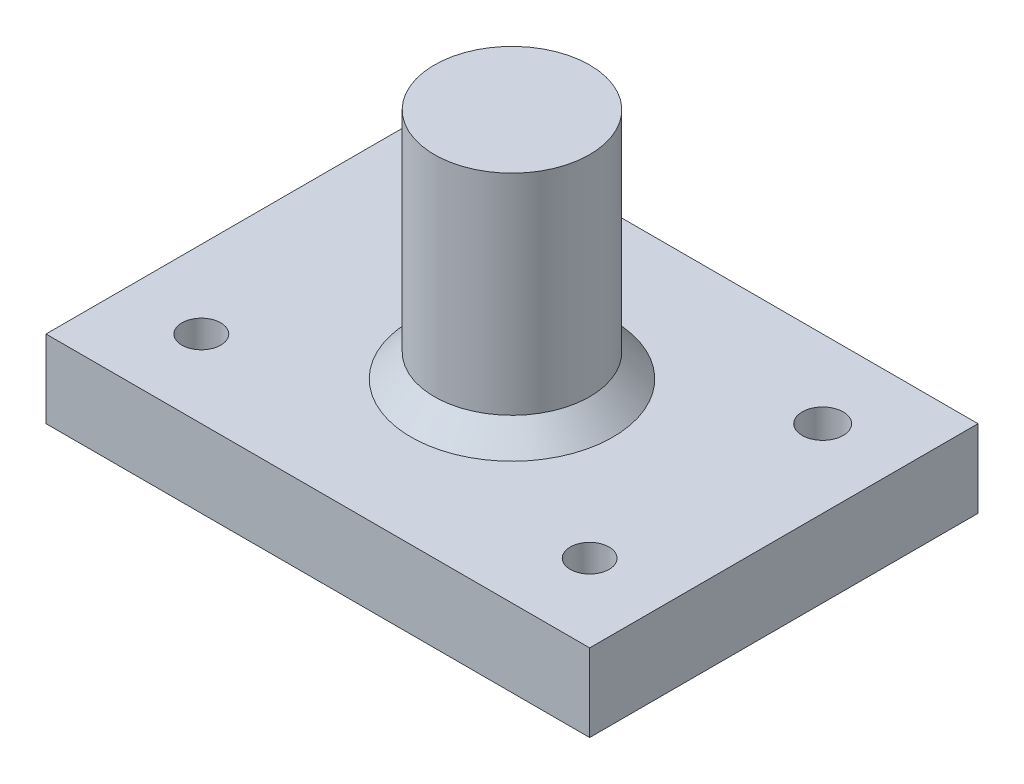
from build123d import *

# Parameters (mm, degrees)
SKETCH1_W           = 88.9
SKETCH1_H           = 63.5
SKETCH1_R           = 3.175
SKETCH1_R_2         = 3.349234597
BOSS_EXTRUDE1_DEPTH = 12.7
SKETCH2_R           = 12.7
BOSS_EXTRUDE2_DEPTH = 38.1
CHAMFER1_SIZE       = 3.81


with BuildPart() as part:
    # Sketch1 → Boss-Extrude1 (new body)
    with BuildSketch(Plane(origin=(0, 0, 0), x_dir=(1, 0, 0), z_dir=(0, 1, 0))):
        Rectangle(SKETCH1_W, SKETCH1_H)
        with Locations(Location((-31.75, 19.05, 0), (0, 0, 270))):
            Circle(SKETCH1_R, mode=Mode.SUBTRACT)
        with Locations(Location((-31.75, -19.05, 0), (0, 0, 270))):
            Circle(SKETCH1_R, mode=Mode.SUBTRACT)
        with Locations(Location((31.75, -19.05, 0), (0, 0, 270))):
            Circle(SKETCH1_R, mode=Mode.SUBTRACT)
        with Locations(Location((31.75, 19.05, 0), (0, 0, 270))):
            Circle(SKETCH1_R_2, mode=Mode.SUBTRACT)
    extrude(amount=BOSS_EXTRUDE1_DEPTH)

    # Sketch2 → Boss-Extrude2 (add)
    with BuildSketch(Plane(origin=(0, 12.7, 0), x_dir=(1, 0, 0), z_dir=(0, 1, 0))):
        with Locations(Location((0, 0, 0), (0, 0, 90))):
            Circle(SKETCH2_R)
    extrude(amount=BOSS_EXTRUDE2_DEPTH)

    # Chamfer1
    chamfer1_edges = [part.edges().sort_by_distance(p)[0] for p in [
        (0, 12.7, 12.7),
    ]]
    chamfer(chamfer1_edges, length=CHAMFER1_SIZE)


solid = part.part
